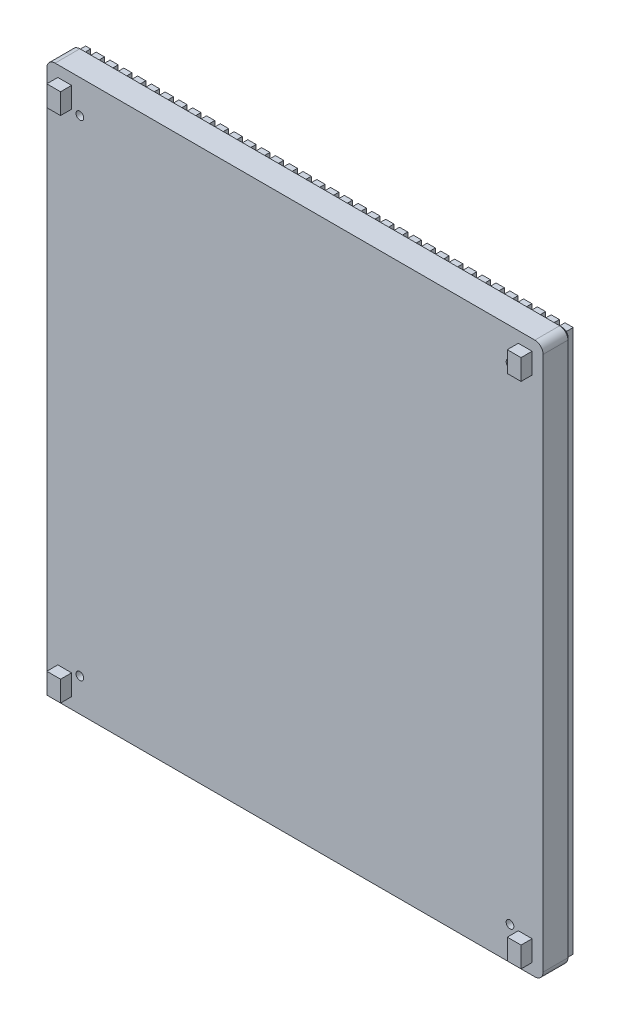
from build123d import *
from OCP.BRepFilletAPI import BRepFilletAPI_MakeChamfer

# Parameters (mm, degrees)
SKETCH1_W               = 180
SKETCH1_H               = 200
SKETCH1_R               = 1.4
BOSS_EXTRUDE1_DEPTH     = 10
FILLET1_R               = 3
CHAMFER1_SIZE           = 5
CHAMFER1_SIZE2          = 4.195498156
CHAMFER2_SIZE           = 1
SKETCH2_W               = 4.99
SKETCH2_H               = 7.49
BOSS_EXTRUDE2_DEPTH     = 4
MIRROR2_COPY_1_SKETCH_W = 4.99
MIRROR2_COPY_1_SKETCH_H = 7.49
MIRROR2_COPY_1_DEPTH    = 4
SKETCH3_W               = 3
SKETCH3_H               = 196.828427124
BOSS_EXTRUDE3_DEPTH     = 2.5
SKETCH4_W               = 3
SKETCH4_H               = 196.828427124
BOSS_EXTRUDE5_DEPTH     = 2.5
LPATTERN2_COUNT         = 13
LPATTERN2_PITCH         = 10
SKETCH5_W               = 3
SKETCH5_H               = 196.828427124
SKETCH5_W_2             = 1.828427124
BOSS_EXTRUDE6_DEPTH     = 2.5


with BuildPart() as part:
    # Sketch1 → Boss-Extrude1 (new body)
    with BuildSketch(Plane.XY):
        with Locations((-90, 100)):
            Rectangle(SKETCH1_W, SKETCH1_H)
        with Locations((-168, 188)):
            Circle(SKETCH1_R, mode=Mode.SUBTRACT)
        with Locations((-12, 188)):
            Circle(SKETCH1_R, mode=Mode.SUBTRACT)
        with Locations((-12, 12)):
            Circle(SKETCH1_R, mode=Mode.SUBTRACT)
        with Locations((-168, 12)):
            Circle(SKETCH1_R, mode=Mode.SUBTRACT)
    extrude(amount=BOSS_EXTRUDE1_DEPTH)

    # Fillet1
    fillet1_edges = [part.edges().sort_by_distance(p)[0] for p in [
        (-180, 200, 5),
        (0, 200, 5),
        (0, 0, 5),
        (-180, 0, 5),
    ]]
    fillet(fillet1_edges, radius=FILLET1_R)

    # Chamfer1: one chamfer whose edges measure the first distance from different faces: ONE call of the kernel's chamfer builder (chamfer() names one face for all edges)
    chamfer1_edges_1 = [part.edges().sort_by_distance(p)[0] for p in [
        (-169.4, 188, 0),
    ]]
    chamfer1_side_1 = [part.faces().sort_by_distance(p)[0] for p in [
        (-169.4, 188, 5),
    ]]
    chamfer1_edges_2 = [part.edges().sort_by_distance(p)[0] for p in [
        (-13.4, 188, 0),
    ]]
    chamfer1_side_2 = [part.faces().sort_by_distance(p)[0] for p in [
        (-13.4, 188, 5),
    ]]
    chamfer1_edges_3 = [part.edges().sort_by_distance(p)[0] for p in [
        (-13.4, 12, 0),
    ]]
    chamfer1_side_3 = [part.faces().sort_by_distance(p)[0] for p in [
        (-13.4, 12, 5),
    ]]
    chamfer1_edges_4 = [part.edges().sort_by_distance(p)[0] for p in [
        (-169.4, 12, 0),
    ]]
    chamfer1_side_4 = [part.faces().sort_by_distance(p)[0] for p in [
        (-169.4, 12, 5),
    ]]
    chamfer1 = BRepFilletAPI_MakeChamfer(part.part.solid().wrapped)
    for e in chamfer1_edges_1:
        chamfer1.Add(CHAMFER1_SIZE, CHAMFER1_SIZE2, e.wrapped, chamfer1_side_1[0].wrapped)  # the first distance lies on this face
    for e in chamfer1_edges_2:
        chamfer1.Add(CHAMFER1_SIZE, CHAMFER1_SIZE2, e.wrapped, chamfer1_side_2[0].wrapped)  # the first distance lies on this face
    for e in chamfer1_edges_3:
        chamfer1.Add(CHAMFER1_SIZE, CHAMFER1_SIZE2, e.wrapped, chamfer1_side_3[0].wrapped)  # the first distance lies on this face
    for e in chamfer1_edges_4:
        chamfer1.Add(CHAMFER1_SIZE, CHAMFER1_SIZE2, e.wrapped, chamfer1_side_4[0].wrapped)  # the first distance lies on this face
    add(Compound.cast(chamfer1.Shape()), mode=Mode.REPLACE)

    # Chamfer2
    chamfer2_edges = [part.edges().sort_by_distance(p)[0] for p in [
        (0, 100, 0),
        (-180, 100, 0),
        (-90, 200, 0),
        (-90, 0, 0),
        (-0.878679656, 199.121320344, 0),
        (-179.121320344, 199.121320344, 0),
        (-179.121320344, 0.878679656, 0),
        (-0.878679656, 0.878679656, 0),
    ]]
    chamfer(chamfer2_edges, length=CHAMFER2_SIZE)

    # Sketch2 → Boss-Extrude2 (add)
    with BuildSketch(Plane.XY.offset(10)):
        with Locations((-173.505, 192.255)):
            Rectangle(SKETCH2_W, SKETCH2_H)
    boss_extrude2 = extrude(amount=BOSS_EXTRUDE2_DEPTH)

    # Mirror1: Boss-Extrude2 across plane
    add(boss_extrude2.mirror(Plane(origin=(-90, 0, 0), x_dir=(0, 0, 1), z_dir=(1, 0, 0))))

    # Mirror2: Boss-Extrude2 across plane
    add(boss_extrude2.mirror(Plane.ZX.offset(100)))

    # Mirror2 copy 1 sketch → Mirror2 copy 1 (add)
    with BuildSketch(Plane(origin=(-180, 200, 10), x_dir=(-1, 0, 0), z_dir=(0, 0, 1))):
        with Locations((-173.505, 192.255)):
            Rectangle(MIRROR2_COPY_1_SKETCH_W, MIRROR2_COPY_1_SKETCH_H)
    extrude(amount=MIRROR2_COPY_1_DEPTH)

    # Sketch3 → Boss-Extrude3 (add)
    with BuildSketch(Plane(origin=(0, 0, 0), x_dir=(-1, 0, 0), z_dir=(0, 0, -1))):
        with Locations((3.085786438, 100)):
            Rectangle(SKETCH3_W, SKETCH3_H)
        with BuildLine():
            Line((6.585786438, 186.587239895), (6.585786438, 13.412760105))
            ThreePointArc((6.585786438, 13.412760105), (7.684376479, 15.561599814), (9.585786438, 17.047887923))
            Line((9.585786438, 17.047887923), (9.585786438, 182.952112077))
            ThreePointArc((9.585786438, 182.952112077), (7.684376479, 184.438400186), (6.585786438, 186.587239895))
        make_face()
        with BuildLine():
            Line((6.585786438, 198.414213562), (6.585786438, 189.412760105))
            ThreePointArc((6.585786438, 189.412760105), (7.684376479, 191.561599814), (9.585786438, 193.047887923))
            Line((9.585786438, 193.047887923), (9.585786438, 198.414213562))
            Line((9.585786438, 198.414213562), (6.585786438, 198.414213562))
        make_face()
        with BuildLine():
            Line((11.585786438, 182.419854237), (11.585786438, 17.580145763))
            ThreePointArc((11.585786438, 17.580145763), (13.128893347, 17.480437886), (14.585786438, 16.962187835))
            Line((14.585786438, 16.962187835), (14.585786438, 183.037812165))
            ThreePointArc((14.585786438, 183.037812165), (13.128893347, 182.519562114), (11.585786438, 182.419854237))
        make_face()
        with BuildLine():
            ThreePointArc((17.595498156, 12), (17.337104045, 10.319250159), (16.585786438, 8.793730772))
            Line((16.585786438, 8.793730772), (16.585786438, 1.585786438))
            Line((16.585786438, 1.585786438), (19.585786438, 1.585786438))
            Line((19.585786438, 1.585786438), (19.585786438, 198.414213562))
            Line((19.585786438, 198.414213562), (16.585786438, 198.414213562))
            Line((16.585786438, 198.414213562), (16.585786438, 191.206269228))
            ThreePointArc((16.585786438, 191.206269228), (17.337104045, 189.680749841), (17.595498156, 188))
            ThreePointArc((17.595498156, 188), (17.337104045, 186.319250159), (16.585786438, 184.793730772))
            Line((16.585786438, 184.793730772), (16.585786438, 15.206269228))
            ThreePointArc((16.585786438, 15.206269228), (17.337104045, 13.680749841), (17.595498156, 12))
        make_face()
        with BuildLine():
            Line((11.585786438, 198.414213562), (11.585786438, 193.580145763))
            ThreePointArc((11.585786438, 193.580145763), (13.128893347, 193.480437886), (14.585786438, 192.962187835))
            Line((14.585786438, 192.962187835), (14.585786438, 198.414213562))
            Line((14.585786438, 198.414213562), (11.585786438, 198.414213562))
        make_face()
        with BuildLine():
            ThreePointArc((9.585786438, 6.952112077), (7.684376479, 8.438400186), (6.585786438, 10.587239895))
            Line((6.585786438, 10.587239895), (6.585786438, 1.585786438))
            Line((6.585786438, 1.585786438), (9.585786438, 1.585786438))
            Line((9.585786438, 1.585786438), (9.585786438, 6.952112077))
        make_face()
        with BuildLine():
            ThreePointArc((14.585786438, 7.037812165), (13.128893347, 6.519562114), (11.585786438, 6.419854237))
            Line((11.585786438, 6.419854237), (11.585786438, 1.585786438))
            Line((11.585786438, 1.585786438), (14.585786438, 1.585786438))
            Line((14.585786438, 1.585786438), (14.585786438, 7.037812165))
        make_face()
    extrude(amount=BOSS_EXTRUDE3_DEPTH)

    # Sketch4 → Boss-Extrude5 (add)
    with BuildSketch(Plane(origin=(0, 0, 0), x_dir=(-1, 0, 0), z_dir=(0, 0, -1))):
        with Locations((23.085786438, 100)):
            Rectangle(SKETCH4_W, SKETCH4_H)
        with Locations((28.085786438, 100)):
            Rectangle(SKETCH4_W, SKETCH4_H)
        with Locations((33.085786438, 100)):
            Rectangle(SKETCH4_W, SKETCH4_H)
    boss_extrude5 = extrude(amount=BOSS_EXTRUDE5_DEPTH)

    # LPattern2: Boss-Extrude5 ×13
    with Locations(*[(-i * LPATTERN2_PITCH, 0, 0) for i in range(1, LPATTERN2_COUNT)]):
        add(boss_extrude5)

    # Sketch5 → Boss-Extrude6 (add)
    with BuildSketch(Plane(origin=(0, 0, 0), x_dir=(-1, 0, 0), z_dir=(0, 0, -1))):
        with Locations((158.085786438, 100)):
            Rectangle(SKETCH5_W, SKETCH5_H)
        with BuildLine():
            ThreePointArc((164.585786438, 7.566858297), (162.404501844, 12), (164.585786438, 16.433141703))
            Line((164.585786438, 16.433141703), (164.585786438, 183.566858297))
            ThreePointArc((164.585786438, 183.566858297), (162.404501844, 188), (164.585786438, 192.433141703))
            Line((164.585786438, 192.433141703), (164.585786438, 198.414213562))
            Line((164.585786438, 198.414213562), (161.585786438, 198.414213562))
            Line((161.585786438, 198.414213562), (161.585786438, 1.585786438))
            Line((161.585786438, 1.585786438), (164.585786438, 1.585786438))
            Line((164.585786438, 1.585786438), (164.585786438, 7.566858297))
        make_face()
        with BuildLine():
            Line((166.585786438, 198.414213562), (166.585786438, 193.413834095))
            ThreePointArc((166.585786438, 193.413834095), (168.089046496, 193.59478957), (169.585786438, 193.366086189))
            Line((169.585786438, 193.366086189), (169.585786438, 198.414213562))
            Line((169.585786438, 198.414213562), (166.585786438, 198.414213562))
        make_face()
        with BuildLine():
            Line((171.585786438, 183.704451696), (171.585786438, 16.295548304))
            ThreePointArc((171.585786438, 16.295548304), (173.068227551, 14.371216799), (173.595498156, 12))
            ThreePointArc((173.595498156, 12), (173.068227551, 9.628783201), (171.585786438, 7.704451696))
            Line((171.585786438, 7.704451696), (171.585786438, 1.585786438))
            Line((171.585786438, 1.585786438), (174.585786438, 1.585786438))
            Line((174.585786438, 1.585786438), (174.585786438, 198.414213562))
            Line((174.585786438, 198.414213562), (171.585786438, 198.414213562))
            Line((171.585786438, 198.414213562), (171.585786438, 192.295548304))
            ThreePointArc((171.585786438, 192.295548304), (173.068227551, 190.371216799), (173.595498156, 188))
            ThreePointArc((173.595498156, 188), (173.068227551, 185.628783201), (171.585786438, 183.704451696))
        make_face()
        with Locations((177.5, 100)):
            Rectangle(SKETCH5_W_2, SKETCH5_H)
        with BuildLine():
            Line((166.585786438, 182.586165905), (166.585786438, 17.413834095))
            ThreePointArc((166.585786438, 17.413834095), (168.089046496, 17.59478957), (169.585786438, 17.366086189))
            Line((169.585786438, 17.366086189), (169.585786438, 182.633913811))
            ThreePointArc((169.585786438, 182.633913811), (168.089046496, 182.40521043), (166.585786438, 182.586165905))
        make_face()
        with BuildLine():
            ThreePointArc((169.585786438, 6.633913811), (168.089046496, 6.40521043), (166.585786438, 6.586165905))
            Line((166.585786438, 6.586165905), (166.585786438, 1.585786438))
            Line((166.585786438, 1.585786438), (169.585786438, 1.585786438))
            Line((169.585786438, 1.585786438), (169.585786438, 6.633913811))
        make_face()
    extrude(amount=BOSS_EXTRUDE6_DEPTH)


solid = part.part
